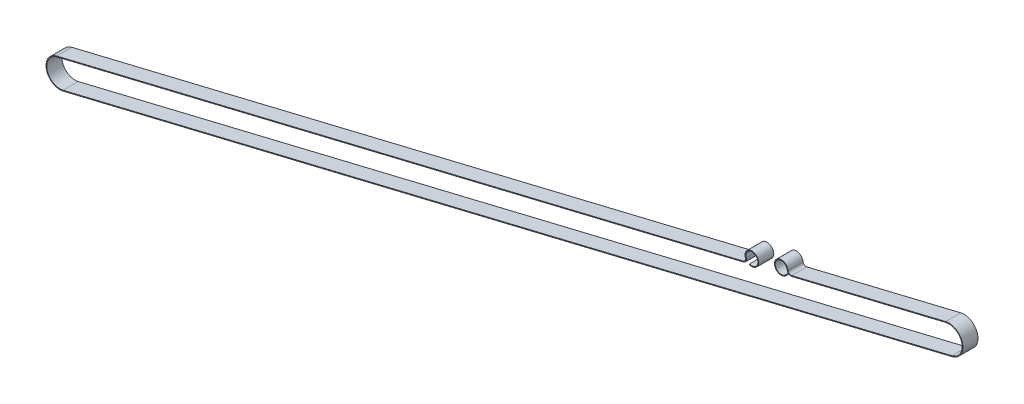
from build123d import *

# Parameters (mm, degrees)
EXTRUDE_1_DEPTH = 20


with BuildPart() as part:
    # Эскиз1 → Вытянуть-Тонкостенный1 (new body)
    with BuildSketch(Plane.XY):
        with BuildLine():
            ThreePointArc((912.491816875, 238.182711116), (921.250664821, 251.157512727), (907.99238472, 242.833997667))
            ThreePointArc((907.99238472, 242.833997667), (907.709433669, 238.751494744), (904.472489462, 236.247680931))
            Line((904.472489462, 236.247680931), (-4.104867197, 17.011762557))
            ThreePointArc((-4.104867197, 17.011762557), (-17.011762557, -4.104867197), (4.104867197, -17.011762557))
            Line((4.104867197, -17.011762557), (1180.346735421, 266.81048364))
            ThreePointArc((1180.346735421, 266.81048364), (1193.253630781, 287.927113394), (1172.137001027, 300.834008754))
            Line((1172.137001027, 300.834008754), (968.462324862, 251.688160741))
            ThreePointArc((968.462324862, 251.688160741), (964.439737623, 252.440279959), (962.326140621, 255.944505854))
            ThreePointArc((962.326140621, 255.944505854), (946.7309564, 257.30580058), (960.442997448, 249.753130556))
            Line((960.442997448, 249.753130556), (961.20027756, 249.100040338))
            ThreePointArc((961.20027756, 249.100040338), (945.774231381, 257.596794115), (963.318813629, 256.065337549))
            ThreePointArc((963.318813629, 256.065337549), (965.009691231, 253.261956833), (968.227761022, 252.660261458))
            Line((968.227761022, 252.660261458), (1171.902437187, 301.806109471))
            ThreePointArc((1171.902437187, 301.806109471), (1194.225731499, 288.161677234), (1180.581299261, 265.838382922))
            Line((1180.581299261, 265.838382922), (4.339431037, -17.983863275))
            ThreePointArc((4.339431037, -17.983863275), (-17.983863275, -4.339431037), (-4.339431037, 17.983863275))
            Line((-4.339431037, 17.983863275), (904.237925622, 237.219781649))
            ThreePointArc((904.237925622, 237.219781649), (906.827480988, 239.222832699), (907.053841829, 242.488835037))
            ThreePointArc((907.053841829, 242.488835037), (921.969406942, 251.852789481), (912.115703003, 237.256137668))
            Line((912.115703003, 237.256137668), (912.491816875, 238.182711116))
        make_face()
    extrude(amount=EXTRUDE_1_DEPTH)


solid = part.part
